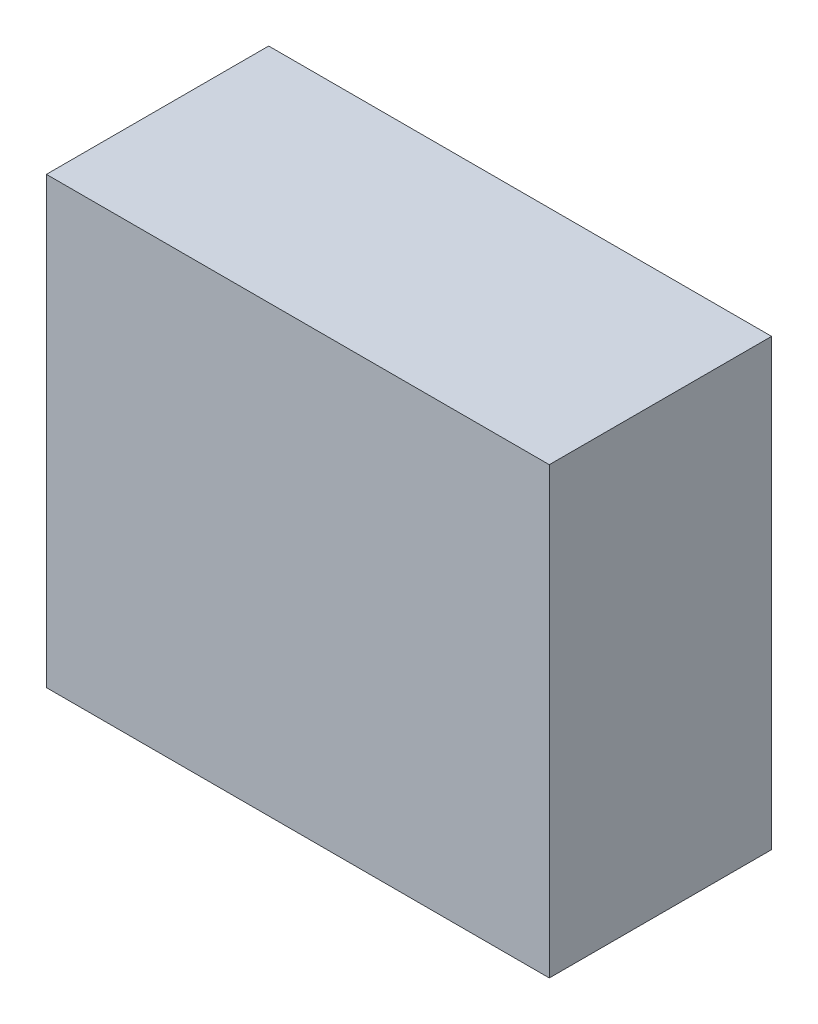
from build123d import *

# Parameters (mm, degrees)
SKETCH1_W           = 18.1
SKETCH1_H           = 8
BOSS_EXTRUDE1_DEPTH = 16


with BuildPart() as part:
    # Sketch1 → Boss-Extrude1 (new body)
    with BuildSketch(Plane(origin=(0, 0, 0), x_dir=(1, 0, 0), z_dir=(0, 1, 0))):
        with Locations((9.05, -4)):
            Rectangle(SKETCH1_W, SKETCH1_H)
    extrude(amount=BOSS_EXTRUDE1_DEPTH)


solid = part.part
